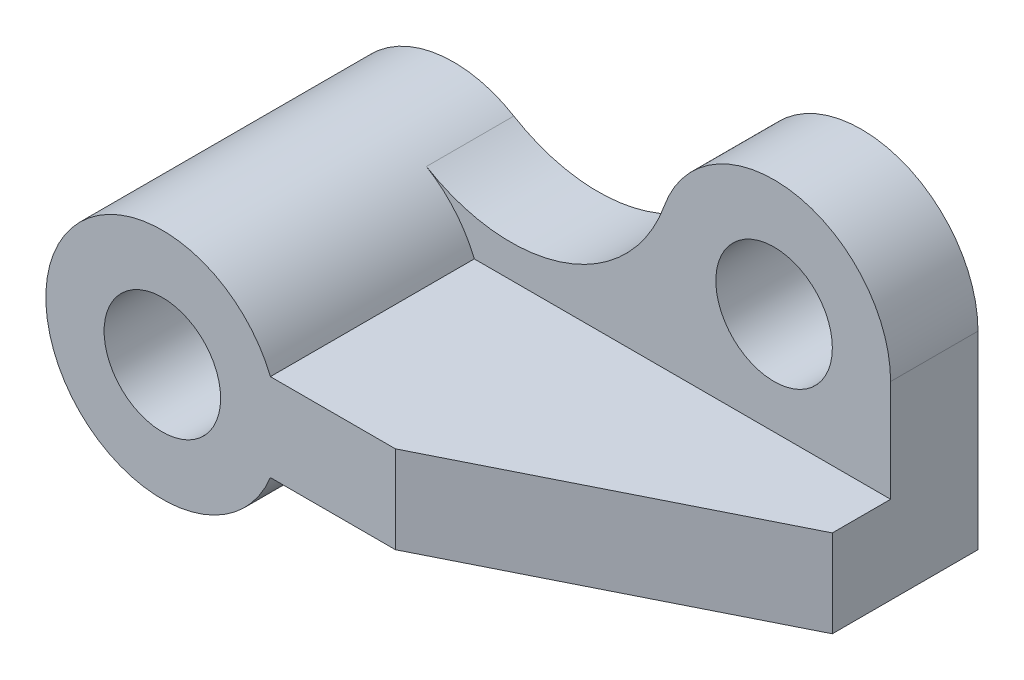
from build123d import *

# Parameters (mm, degrees)
SKETCH3_R           = 10
BOSS_EXTRUDE2_DEPTH = 50
SKETCH3_4_R         = 10
BOSS_EXTRUDE3_DEPTH = 15
CHAMFER1_SIZE       = 50
CHAMFER1_SIZE2      = 25


with BuildPart() as part:
    # Sketch3 → Boss-Extrude2 (new body)
    with BuildSketch(Plane.XY):
        with BuildLine():
            Line((90, -7.5), (90, 7.5))
            Line((90, 7.5), (18.540496218, 7.5))
            ThreePointArc((18.540496218, 7.5), (15.215049384, 12.980842508), (10.326323506, 17.127960849))
            ThreePointArc((10.326323506, 17.127960849), (-18.972544219, -6.327919552), (18.540496218, -7.5))
            Line((18.540496218, -7.5), (90, -7.5))
        make_face()
        Circle(SKETCH3_R, mode=Mode.SUBTRACT)
    extrude(amount=BOSS_EXTRUDE2_DEPTH)

    # Sketch3<4> → Boss-Extrude3 (add)
    with BuildSketch(Plane.XY):
        with BuildLine():
            Line((90, 7.5), (90, 25))
            ThreePointArc((90, 25), (73.405373459, 44.707953511), (51.15965684, 31.711294182))
            ThreePointArc((51.15965684, 31.711294182), (34.200595531, 14.738332513), (10.326323506, 17.127960849))
            ThreePointArc((10.326323506, 17.127960849), (15.215049384, 12.980842508), (18.540496218, 7.5))
            Line((18.540496218, 7.5), (90, 7.5))
        make_face()
        with Locations((70, 25)):
            Circle(SKETCH3_4_R, mode=Mode.SUBTRACT)
    extrude(amount=BOSS_EXTRUDE3_DEPTH)

    # Chamfer1
    chamfer1_edges = [part.edges().sort_by_distance(p)[0] for p in [
        (90, 0, 50),
    ]]
    chamfer1_side = [part.faces().sort_by_distance(p)[0] for p in [
        (28.950156373, 0, 50),
    ]]
    chamfer(chamfer1_edges, length=CHAMFER1_SIZE, length2=CHAMFER1_SIZE2, reference=chamfer1_side[0])


solid = part.part
